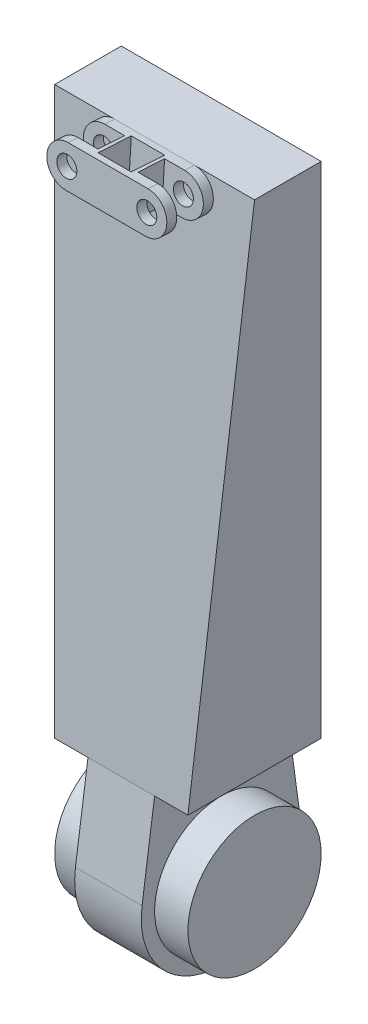
from build123d import *

# Parameters (mm, degrees)
SALIENTE_EXTRUIR1_DEPTH = 5
CROQUIS4_R              = 10
SALIENTE_EXTRUIR2_DEPTH = 10
CROQUIS5_R              = 1.5
SALIENTE_EXTRUIR3_DEPTH = 7
CORTAR_EXTRUIR1_REACH   = 110.601
CROQUIS6_W              = 6
CROQUIS6_H              = 4
CROQUIS7_W              = 5
CROQUIS7_H              = 5
CORTAR_EXTRUIR2_DEPTH   = 6


with BuildPart() as part:
    # Croquis2 → Recubrir1 section 0
    with BuildSketch(Plane(origin=(0, 40, 0), x_dir=(1, 0, 0), z_dir=(0, 1, 0))):
        with BuildLine():
            Line((15, -5), (-15, -5))
            Line((-15, -5), (-15, 5))
            Line((-15, 5), (15, 5))
            Line((15, 5), (15, -5))
        make_face()
    # Croquis1 → Recubrir1 section 1
    with BuildSketch(Plane(origin=(0, -40, 0), x_dir=(1, 0, 0), z_dir=(0, 1, 0))):
        with BuildLine():
            Line((-10, 10), (10, 10))
            Line((10, 10), (10, -10))
            Line((10, -10), (-10, -10))
            Line((-10, -10), (-10, 10))
        make_face()
    loft()

    # Croquis3 → Saliente-Extruir1 (add, symmetric)
    with BuildSketch(Plane(origin=(0, 0, 0), x_dir=(0, 0, -1), z_dir=(1, 0, 0))):
        with BuildLine():
            Line((-10, -40), (-11.882007165, -53.32133811))
            ThreePointArc((-11.882007165, -53.32133811), (0.627532313, -66.983580567), (11.641690846, -52.089495878))
            Line((11.641690846, -52.089495878), (10, -40))
            Line((10, -40), (-10, -40))
        make_face()
    extrude(amount=SALIENTE_EXTRUIR1_DEPTH, both=True)

    # Croquis4 → Saliente-Extruir2 (add, symmetric)
    with BuildSketch(Plane(origin=(0, 0, 0), x_dir=(0, 0, -1), z_dir=(1, 0, 0))):
        with Locations((0, -55)):
            Circle(CROQUIS4_R)
    extrude(amount=SALIENTE_EXTRUIR2_DEPTH, both=True)

    # Croquis5 → Saliente-Extruir3 (add)
    with BuildSketch(Plane(origin=(0, 0.46692607, 7.470817121), x_dir=(1, 0, 0), z_dir=(0, 0.062378286155180505, 0.9980525784828886))):
        with BuildLine():
            Line((6, 33.610211709), (-6, 33.610211709))
            ThreePointArc((-6, 33.610211709), (-9, 36.610211709), (-6, 39.610211709))
            Line((-6, 39.610211709), (6, 39.610211709))
            ThreePointArc((6, 39.610211709), (9, 36.610211709), (6, 33.610211709))
        make_face()
        with Locations(Location((-6, 36.610211709, 0), (0, 0, 270))):
            Circle(CROQUIS5_R, mode=Mode.SUBTRACT)
        with Locations(Location((6, 36.610211709, 0), (0, 0, 270))):
            Circle(CROQUIS5_R, mode=Mode.SUBTRACT)
    extrude(amount=SALIENTE_EXTRUIR3_DEPTH)

    # Cortar-Extruir1: up to this face of the body (flat: up to its plane)
    cortar_extruir1_end = Plane(part.part.faces().sort_by_distance((0, 34.230008531, 8.867453742))[0])
    # Croquis6 → Cortar-Extruir1 (cut, up to the picked face)
    with BuildSketch(Plane(origin=(0, 39.53307393, -2.470817121), x_dir=(1, 0, 0), z_dir=(0, 0.9980525784828886, -0.062378286155180505)), mode=Mode.PRIVATE) as cortar_extruir1_sk1:
        with Locations((6, -10.985394339)):
            Rectangle(CROQUIS6_W, CROQUIS6_H)
    cortar_extruir1_tool1 = split(extrude(cortar_extruir1_sk1.sketch, amount=-CORTAR_EXTRUIR1_REACH, mode=Mode.PRIVATE), bisect_by=cortar_extruir1_end, keep=Keep.BOTH, mode=Mode.PRIVATE)
    # Croquis6 → Cortar-Extruir1 (cut, up to the picked face)
    with BuildSketch(Plane(origin=(0, 39.53307393, -2.470817121), x_dir=(1, 0, 0), z_dir=(0, 0.9980525784828886, -0.062378286155180505)), mode=Mode.PRIVATE) as cortar_extruir1_sk2:
        with Locations((-6, -10.985394339)):
            Rectangle(CROQUIS6_W, CROQUIS6_H)
    cortar_extruir1_tool2 = split(extrude(cortar_extruir1_sk2.sketch, amount=-CORTAR_EXTRUIR1_REACH, mode=Mode.PRIVATE), bisect_by=cortar_extruir1_end, keep=Keep.BOTH, mode=Mode.PRIVATE)
    add(cortar_extruir1_tool1.solids().sort_by(Axis((6, 40.218324, 8.493184), (0, -0.9980525784828886, 0.062378286155180505)))[0], mode=Mode.SUBTRACT)
    add(cortar_extruir1_tool2.solids().sort_by(Axis((-6, 40.218324, 8.493184), (0, -0.9980525784828886, 0.062378286155180505)))[0], mode=Mode.SUBTRACT)

    # Croquis7 → Cortar-Extruir2 (cut)
    with BuildSketch(Plane(origin=(0, 39.53307393, -2.470817121), x_dir=(1, 0, 0), z_dir=(-1.2640787676290823e-15, 0.9980525784828886, -0.062378286155180505))):
        with Locations((0, -10.985394339)):
            Rectangle(CROQUIS7_W, CROQUIS7_H)
    extrude(amount=-CORTAR_EXTRUIR2_DEPTH, mode=Mode.SUBTRACT)


solid = part.part
